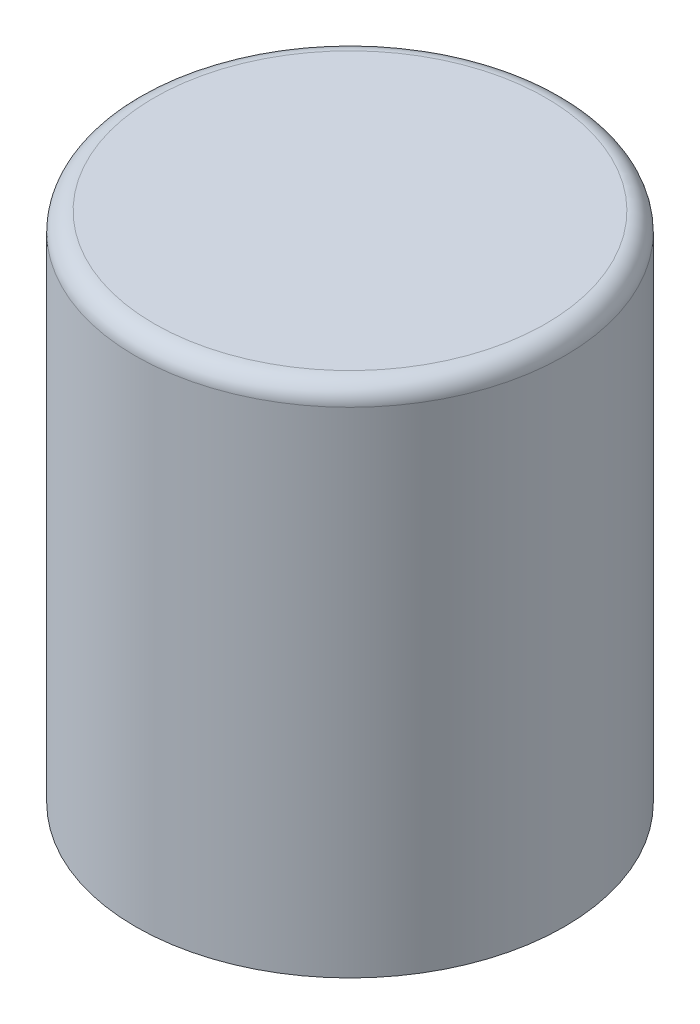
from build123d import *

# Parameters (mm, degrees)
SKETCH_1_R          = 2.3
EXTRUDE_1_DEPTH     = 5.5
FILLET_1_R          = 0.2
SKETCH_2_W          = 2.4
SKETCH_2_H          = 2.4
CUT_EXTRUDE_1_DEPTH = 3.1


with BuildPart() as part:
    # 草图1 → 凸台-拉伸1 (new body)
    with BuildSketch(Plane(origin=(0, 0, 0), x_dir=(1, 0, 0), z_dir=(0, 1, 0))):
        with Locations(Location((0, 0, 0), (0, 0, 270))):
            Circle(SKETCH_1_R)
    extrude(amount=EXTRUDE_1_DEPTH)

    # 圆角1
    fillet_1_edges = [part.edges().sort_by_distance(p)[0] for p in [
        (0, 5.5, -2.3),
    ]]
    fillet(fillet_1_edges, radius=FILLET_1_R)

    # 草图2 → 切除-拉伸1 (cut)
    with BuildSketch(Plane.XZ):
        Rectangle(SKETCH_2_W, SKETCH_2_H)
    extrude(amount=-CUT_EXTRUDE_1_DEPTH, mode=Mode.SUBTRACT)


solid = part.part
